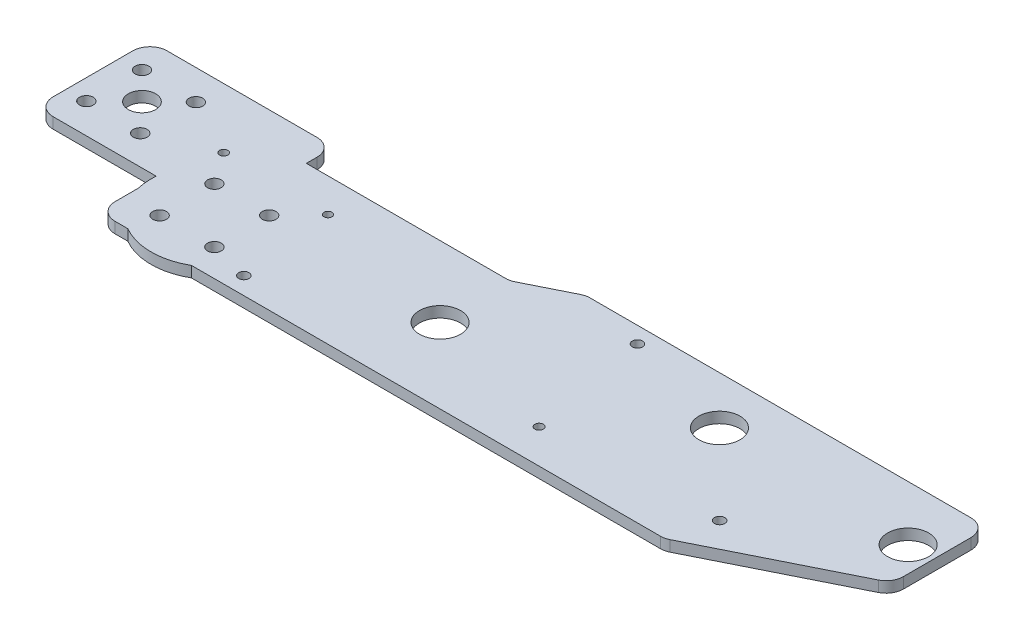
from build123d import *

# Parameters (mm, degrees)
SKETCH1_W           = 210
SKETCH1_H           = 50
SKETCH1_R           = 1.211665018
SKETCH1_R_2         = 1.165617118
SKETCH1_R_3         = 1.5
SKETCH1_R_4         = 1.25
SKETCH1_R_5         = 1.517273905
BOSS_EXTRUDE1_DEPTH = 3.175
SKETCH2_R           = 2
CUT_EXTRUDE1_DEPTH  = 10
SKETCH3_R           = 6
SKETCH3_R_2         = 0.586995366
CUT_EXTRUDE2_DEPTH  = 57.15
CUT_EXTRUDE7_DEPTH  = 10
FILLET3_R           = 5
SKETCH11_R          = 18.5
SKETCH11_R_2        = 2
BOSS_EXTRUDE4_DEPTH = 3.175
SKETCH16_W          = 18.257640281
SKETCH16_H          = 3.175
BOSS_EXTRUDE7_DEPTH = 8.128
SKETCH17_W          = 33.3
SKETCH17_H          = 3.175
BOSS_EXTRUDE8_DEPTH = 35.56
SKETCH18_R          = 2
CUT_EXTRUDE8_DEPTH  = 9
SKETCH19_R          = 4
CUT_EXTRUDE9_DEPTH  = 40
FILLET4_R           = 5


with BuildPart() as part:
    # Sketch1 → Boss-Extrude1 (new body)
    with BuildSketch(Plane(origin=(0, 0, 0), x_dir=(1, 0, 0), z_dir=(0, 1, 0))):
        with Locations((105, -25)):
            Rectangle(SKETCH1_W, SKETCH1_H)
        with Locations(Location((3.489526233, -16.787661112, 0), (0, 0, 270))):
            Circle(SKETCH1_R, mode=Mode.SUBTRACT)
        with Locations(Location((34.37258772, -17.194005245, 0), (0, 0, 270))):
            Circle(SKETCH1_R_2, mode=Mode.SUBTRACT)
        with Locations(Location((37.520749958, -44.921198121, 0), (0, 0, 270))):
            Circle(SKETCH1_R_3, mode=Mode.SUBTRACT)
        with Locations(Location((118.879039361, -40.017685043, 0), (0, 0, 270))):
            Circle(SKETCH1_R_4, mode=Mode.SUBTRACT)
        with Locations(Location((112.302052499, -4.739260115, 0), (0, 0, 270))):
            Circle(SKETCH1_R_3, mode=Mode.SUBTRACT)
        with Locations(Location((168.975233936, -37.403209633, 0), (0, 0, 270))):
            Circle(SKETCH1_R_5, mode=Mode.SUBTRACT)
    extrude(amount=BOSS_EXTRUDE1_DEPTH)

    # Sketch2 → Cut-Extrude1 (cut)
    with BuildSketch(Plane(origin=(0, 3.175, 0), x_dir=(1, 0, 0), z_dir=(0, 1, 0))):
        with Locations(Location((10, -26, 0), (0, 0, 270))):
            Circle(SKETCH2_R)
        with Locations(Location((10, -42, 0), (0, 0, 270))):
            Circle(SKETCH2_R)
        with Locations(Location((26, -26, 0), (0, 0, 270))):
            Circle(SKETCH2_R)
        with Locations(Location((26, -42, 0), (0, 0, 270))):
            Circle(SKETCH2_R)
    extrude(amount=-CUT_EXTRUDE1_DEPTH, mode=Mode.SUBTRACT)

    # Sketch3 → Cut-Extrude2 (cut)
    with BuildSketch(Plane(origin=(0, 3.175, 0), x_dir=(1, 0, 0), z_dir=(0, 1, 0))):
        with Locations(Location((78.01026379, -28.1, 0), (0, 0, 270))):
            Circle(SKETCH3_R)
        with Locations(Location((145.531297368, -14, 0), (0, 0, 270))):
            Circle(SKETCH3_R)
        with Locations(Location((18, -34, 0), (0, 0, 270))):
            Circle(SKETCH3_R_2)
        with Locations(Location((202.646291021, -16, 0), (0, 0, 270))):
            Circle(SKETCH3_R)
    extrude(amount=-CUT_EXTRUDE2_DEPTH, mode=Mode.SUBTRACT)

    # Sketch10 → Cut-Extrude7 (cut)
    with BuildSketch(Plane(origin=(0, 3.175, 0), x_dir=(1, 0, 0), z_dir=(0, 1, 0))):
        Polygon((210, -27.859435908), (165.502877994, -50), (210, -50), align=None)
        Polygon((92.532613397, 0), (77.65477062, -7.402812063), (0, -7.402812063), (0, 0), align=None)
    extrude(amount=-CUT_EXTRUDE7_DEPTH, mode=Mode.SUBTRACT)

    # Fillet3
    fillet3_edges = [part.edges().sort_by_distance(p)[0] for p in [
        (210, 1.5875, 0),
        (92.532613397, 1.5875, 0),
        (210, 1.5875, 27.859435908),
        (165.502877994, 1.5875, 50),
        (77.65477062, 1.5875, 7.402812063),
    ]]
    fillet(fillet3_edges, radius=FILLET3_R)

    # Sketch11 → Boss-Extrude4 (add)
    with BuildSketch(Plane(origin=(0, 3.175, 0), x_dir=(1, 0, 0), z_dir=(0, 1, 0))):
        with Locations((18, -34)):
            Circle(SKETCH11_R)
        with Locations(Location((10, -26, 0), (0, 0, 270))):
            Circle(SKETCH11_R_2, mode=Mode.SUBTRACT)
        with Locations(Location((10, -42, 0), (0, 0, 270))):
            Circle(SKETCH11_R_2, mode=Mode.SUBTRACT)
        with Locations(Location((26, -26, 0), (0, 0, 270))):
            Circle(SKETCH11_R_2, mode=Mode.SUBTRACT)
        with Locations(Location((26, -42, 0), (0, 0, 270))):
            Circle(SKETCH11_R_2, mode=Mode.SUBTRACT)
    extrude(amount=-BOSS_EXTRUDE4_DEPTH)

    # Sketch16 → Boss-Extrude7 (add)
    with BuildSketch(Plane(origin=(0, 0, 7.402812063), x_dir=(-1, 0, 0), z_dir=(0, 0, -1))):
        with Locations((-9.128820141, 1.5875)):
            Rectangle(SKETCH16_W, SKETCH16_H)
    extrude(amount=BOSS_EXTRUDE7_DEPTH)

    # Sketch17 → Boss-Extrude8 (add)
    with BuildSketch(Plane.ZY):
        with Locations((15.924812063, 1.5875)):
            Rectangle(SKETCH17_W, SKETCH17_H)
    extrude(amount=BOSS_EXTRUDE8_DEPTH)

    # Sketch18 → Cut-Extrude8 (cut)
    with BuildSketch(Plane(origin=(0, 3.175, 0), x_dir=(1, 0, 0), z_dir=(0, 1, 0))):
        with Locations(Location((-29.612034681, -23.798543698, 0), (0, 0, 270))):
            Circle(SKETCH18_R)
        with Locations(Location((-29.359661767, -7.798707515, 0), (0, 0, 270))):
            Circle(SKETCH18_R)
        with Locations(Location((-13.359825583, -8.051080428, 0), (0, 0, 270))):
            Circle(SKETCH18_R)
        with Locations(Location((-13.612198497, -24.050916612, 0), (0, 0, 270))):
            Circle(SKETCH18_R)
    extrude(amount=-CUT_EXTRUDE8_DEPTH, mode=Mode.SUBTRACT)

    # Sketch19 → Cut-Extrude9 (cut)
    with BuildSketch(Plane(origin=(0, 3.175, 0), x_dir=(1, 0, 0), z_dir=(0, 1, 0))):
        with Locations(Location((-21.359661767, -15.798707515, 0), (0, 0, 270))):
            Circle(SKETCH19_R)
    extrude(amount=-CUT_EXTRUDE9_DEPTH, mode=Mode.SUBTRACT)

    # Fillet4
    fillet4_edges = [part.edges().sort_by_distance(p)[0] for p in [
        (18.257640281, 1.5875, -0.725187937),
        (-35.56, 1.5875, -0.725187937),
        (-35.56, 1.5875, 32.574812063),
        (0, 1.5875, 50),
    ]]
    fillet(fillet4_edges, radius=FILLET4_R)


solid = part.part
